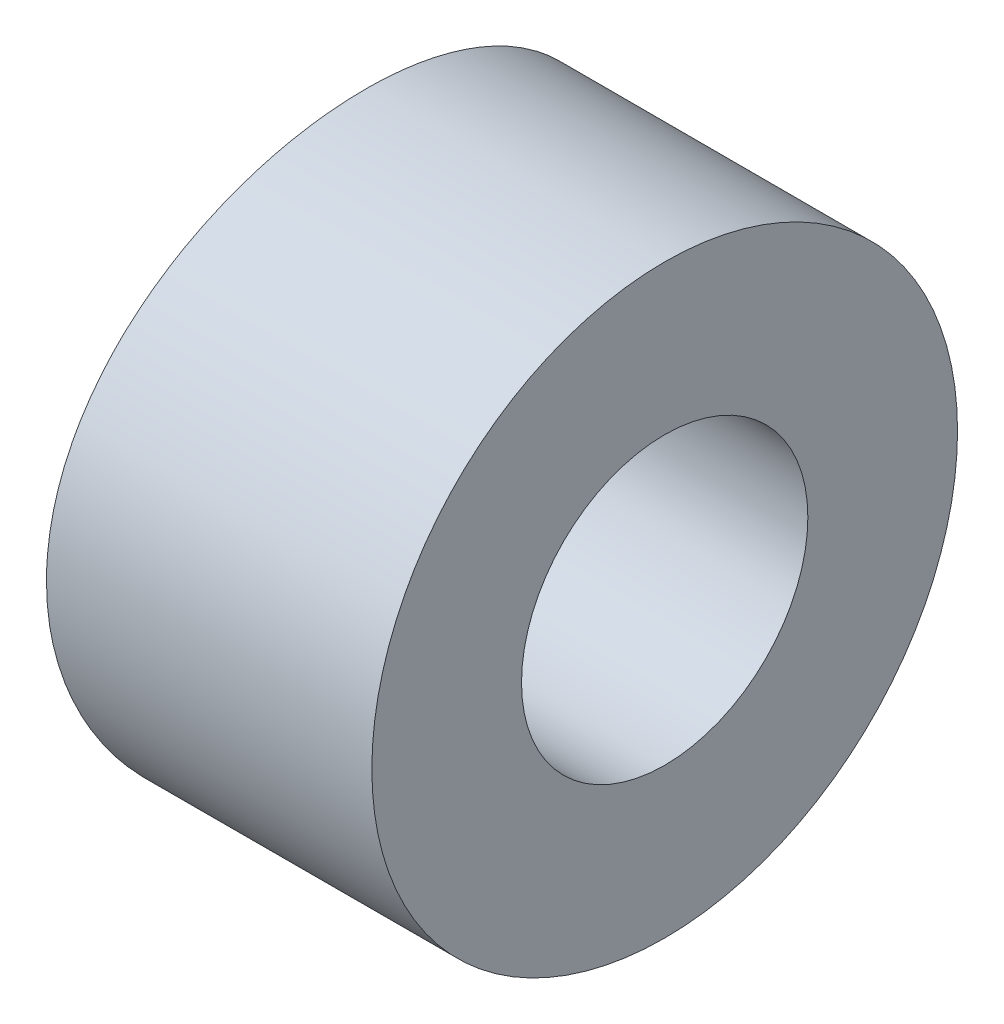
from build123d import *

# Parameters (mm, degrees)
SKETCH1_R               = 2.25
SKETCH1_R_2             = 1.1
BOSS_EXTRUDE1_DEPTH     = 2.5
CUT_EXTRUDE1_DEPTH      = 5.046603514
CUT_EXTRUDE1_DEPTH_BACK = 5.046603514


with BuildPart() as part:
    # Sketch1 → Boss-Extrude1 (new body)
    with BuildSketch(Plane(origin=(0, 0, 0), x_dir=(0, 0, -1), z_dir=(1, 0, 0))):
        Circle(SKETCH1_R)
        Circle(SKETCH1_R_2, mode=Mode.SUBTRACT)
    extrude(amount=BOSS_EXTRUDE1_DEPTH)

    # Sketch4 → Cut-Extrude1 (cut, two sides: drawn at the far end of the back side and taken through both)
    with BuildSketch(Plane(origin=(0, 0, 0), x_dir=(1, 0, 0), z_dir=(0, 1, 0)).offset(-CUT_EXTRUDE1_DEPTH_BACK)):
        with BuildLine():
            Line((0, 2.25), (0, -2.25))
            ThreePointArc((0, -2.25), (0.200900032, 0), (0, 2.25))
        make_face()
    extrude(amount=CUT_EXTRUDE1_DEPTH + CUT_EXTRUDE1_DEPTH_BACK, mode=Mode.SUBTRACT)


solid = part.part
